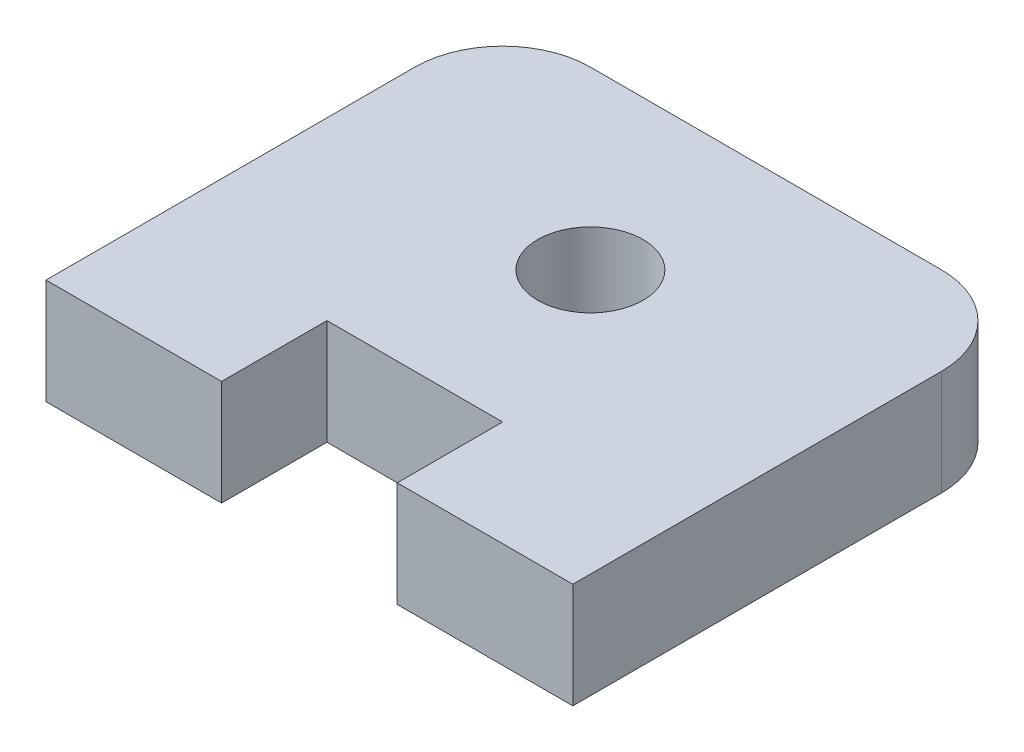
from build123d import *

# Parameters (mm, degrees)
SKETCH1_R           = 1.5
BOSS_EXTRUDE1_DEPTH = 3


with BuildPart() as part:
    # Sketch1 → Boss-Extrude1 (new body)
    with BuildSketch(Plane(origin=(0, 0, 0), x_dir=(1, 0, 0), z_dir=(0, 1, 0))):
        with BuildLine():
            Line((0, 0), (0, 10.5))
            ThreePointArc((0, 10.5), (0.732233047, 12.267766953), (2.5, 13))
            Line((2.5, 13), (12.5, 13))
            ThreePointArc((12.5, 13), (14.267766953, 12.267766953), (15, 10.5))
            Line((15, 10.5), (15, 0))
            Line((15, 0), (10, 0))
            Line((10, 0), (10, 3))
            Line((10, 3), (5, 3))
            Line((5, 3), (5, 0))
            Line((5, 0), (0, 0))
        make_face()
        with Locations(Location((7.5, 8, 0), (0, 0, 270))):
            Circle(SKETCH1_R, mode=Mode.SUBTRACT)
    extrude(amount=BOSS_EXTRUDE1_DEPTH)


solid = part.part
